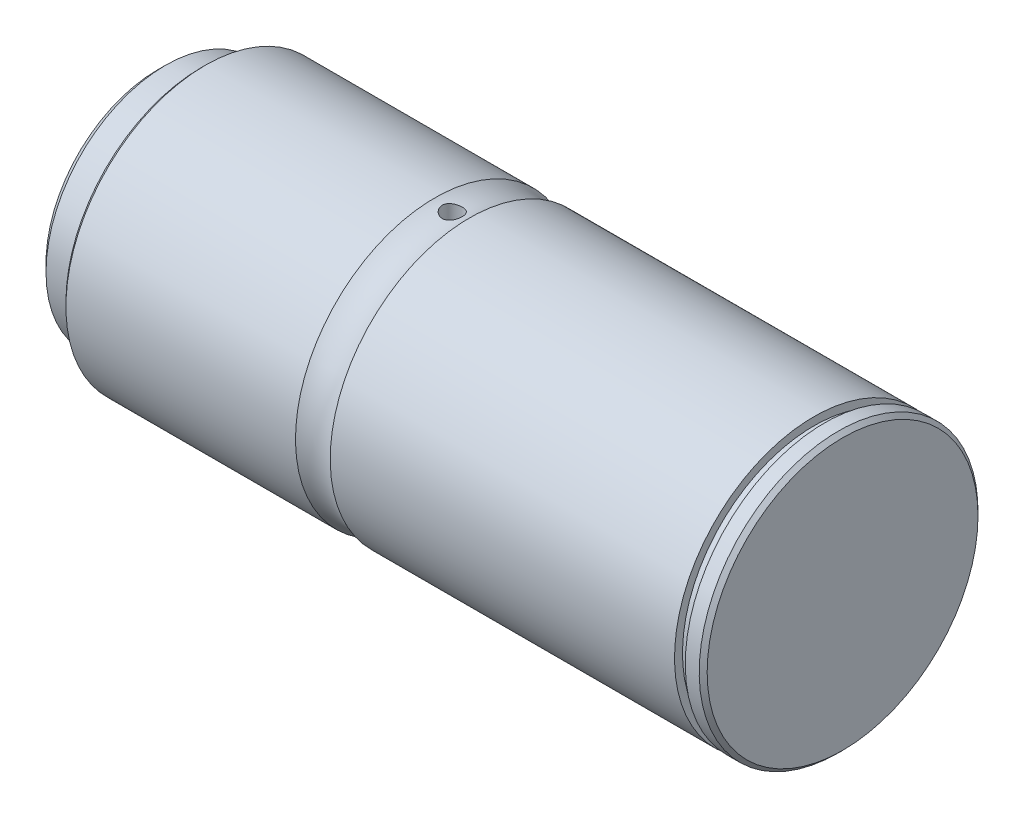
from build123d import *

# Parameters (mm, degrees)
SKETCH_2_R                = 2.5
CUT_EXTRUDE_1_DEPTH       = 50
CHAMFER_1_SIZE            = 2
CHAMFER_2_SIZE            = 1
CHAMFER_3_SIZE            = 1
SKETCH_3_R                = 15
CUT_EXTRUDE_2_DEPTH       = 10
HOLE_WIZARD_8_0_8_2_D     = 8
HOLE_WIZARD_8_0_8_2_DEPTH = 71
HOLE_WIZARD_8_0_8_2_TIP   = 2.403442476
M10X1_0_2_D               = 9
M10X1_0_2_DEPTH           = 20
M10X1_0_2_TIP             = 2.703872786


with BuildPart() as part:
    # 草图1 → 旋转1 (revolve)
    with BuildSketch(Plane.XY, mode=Mode.PRIVATE) as revolve_1_sk:
        with BuildLine():
            Line((0, 0), (172, 0))
            Line((172, 0), (172, 35))
            Line((172, 35), (167.5, 35))
            Line((167.5, 35), (167.5, 33))
            Line((167.5, 33), (164.8, 33))
            Line((164.8, 33), (164.8, 35))
            Line((164.8, 35), (78.358898944, 35))
            ThreePointArc((78.358898944, 35), (74, 34), (69.641101056, 35))
            Line((69.641101056, 35), (11, 35))
            Line((11, 35), (11, 30))
            Line((11, 30), (0, 30))
            Line((0, 30), (0, 0))
        make_face()
    revolve(revolve_1_sk.sketch.rotate(Axis((0, 0, 0), (1, 0, 0)), 180), axis=Axis((0, 0, 0), (1, 0, 0)))

    # 草图2 → 切除-拉伸1 (cut, symmetric)
    with BuildSketch(Plane(origin=(0, 0, 0), x_dir=(1, 0, 0), z_dir=(0, 1, 0))):
        with Locations(Location((74, 0, 0), (0, 0, 145.453943399))):
            Circle(SKETCH_2_R)
    extrude(amount=CUT_EXTRUDE_1_DEPTH, both=True, mode=Mode.SUBTRACT)

    # 倒角1
    chamfer_1_edges = [part.edges().sort_by_distance(p)[0] for p in [
        (0, 30, 0),
    ]]
    chamfer(chamfer_1_edges, length=CHAMFER_1_SIZE)

    # 倒角2
    chamfer_2_edges = [part.edges().sort_by_distance(p)[0] for p in [
        (11, 35, 0),
    ]]
    chamfer(chamfer_2_edges, length=CHAMFER_2_SIZE)

    # 倒角3
    chamfer_3_edges = [part.edges().sort_by_distance(p)[0] for p in [
        (172, 35, 0),
    ]]
    chamfer(chamfer_3_edges, length=CHAMFER_3_SIZE)

    # 草图3 → 切除-拉伸2 (cut)
    with BuildSketch(Plane.ZY):
        with Locations(Location((0, 0, 0), (0, 0, 270))):
            Circle(SKETCH_3_R)
    extrude(amount=-CUT_EXTRUDE_2_DEPTH, mode=Mode.SUBTRACT)

    # Ø8.0 (8) 直径孔2
    with Locations(Plane.ZY.offset(-10)):
        with Locations((0, 0)):
            Hole(HOLE_WIZARD_8_0_8_2_D / 2, depth=HOLE_WIZARD_8_0_8_2_DEPTH)
            with Locations((0, 0, -(HOLE_WIZARD_8_0_8_2_DEPTH + HOLE_WIZARD_8_0_8_2_TIP / 2))):  # 118° drill point
                Cone(0, HOLE_WIZARD_8_0_8_2_D / 2, HOLE_WIZARD_8_0_8_2_TIP, mode=Mode.SUBTRACT)

    # M10x1.0 螺纹孔2
    with Locations(Plane.ZY.offset(-10)):
        with Locations((0, 0)):
            Hole(M10X1_0_2_D / 2, depth=M10X1_0_2_DEPTH)
            with Locations((0, 0, -(M10X1_0_2_DEPTH + M10X1_0_2_TIP / 2))):  # 118° drill point
                Cone(0, M10X1_0_2_D / 2, M10X1_0_2_TIP, mode=Mode.SUBTRACT)


solid = part.part
